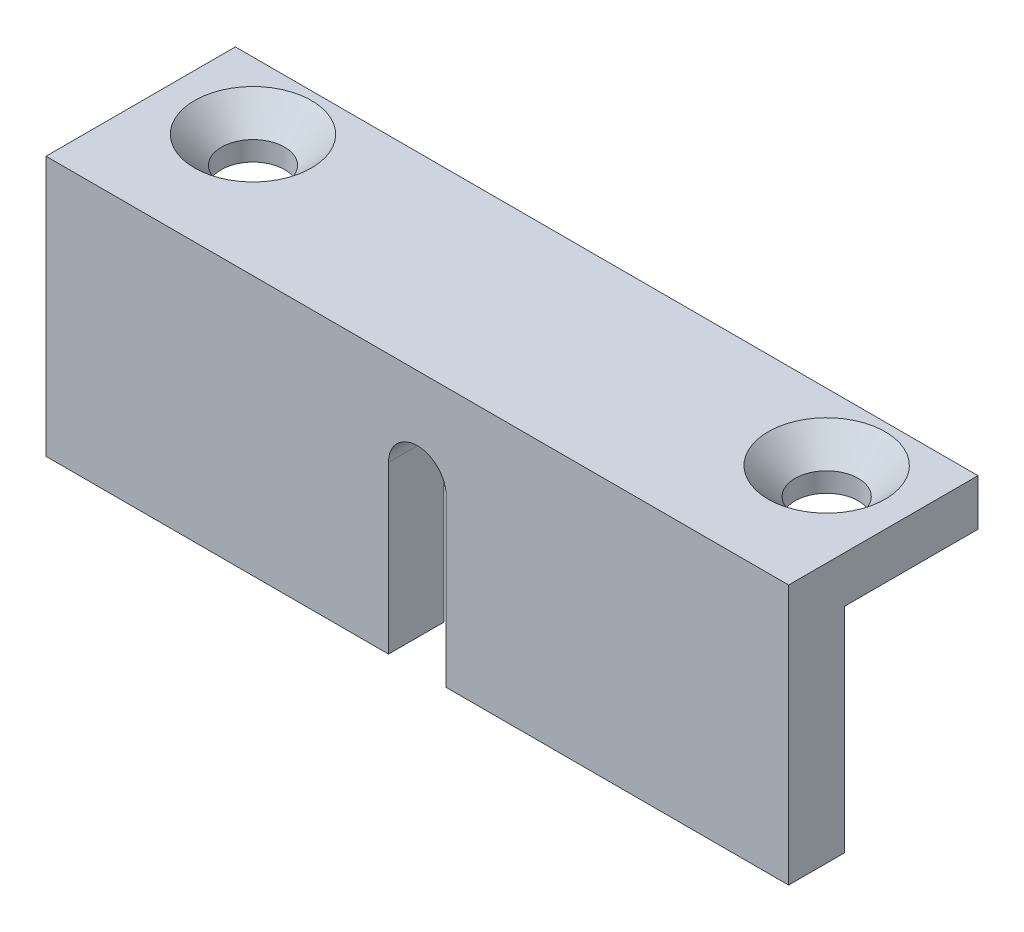
from build123d import *

# Parameters (mm, degrees)
SKETCH1_W                                      = 40
SKETCH1_H                                      = 7.2
BOSS_EXTRUDE1_DEPTH                            = 2.5
CSK_FOR_M3_FLAT_HEAD_MACHINE_SCREW1_AT_2_COUNT = 2
CSK_FOR_M3_FLAT_HEAD_MACHINE_SCREW1_AT_2_PITCH = 30.9
SKETCH4_W                                      = 40
SKETCH4_H                                      = 3
BOSS_EXTRUDE2_DEPTH                            = 14
CUT_EXTRUDE1_DEPTH                             = 43.851954448


with BuildPart() as part:
    # Sketch1 → Boss-Extrude1 (new body)
    with BuildSketch(Plane(origin=(0, 0, 0), x_dir=(1, 0, 0), z_dir=(0, 1, 0))):
        with Locations((20, 3.6)):
            Rectangle(SKETCH1_W, SKETCH1_H)
    extrude(amount=BOSS_EXTRUDE1_DEPTH)

    # Sketch3 → CSK for M3 Flat Head Machine Screw1 (revolve, cut)
    with BuildSketch(Plane(origin=(35.45, 2.5, -3.6), x_dir=(0, 0, 1), z_dir=(1, 0, 0))):
        Polygon((0, 0), (0, 2.5), (1.7, 2.5), (1.7, 1.45), (3.15, 0), align=None)
    csk_for_m3_flat_head_machine_screw1 = revolve(axis=Axis((35.45, 8.85, -3.6), (0, -1, 0)), mode=Mode.SUBTRACT)

    # CSK for M3 Flat Head Machine Screw1 at 2: CSK for M3 Flat Head Machine Screw1 ×2
    with Locations(*[(-i * CSK_FOR_M3_FLAT_HEAD_MACHINE_SCREW1_AT_2_PITCH, 0, 0) for i in range(1, CSK_FOR_M3_FLAT_HEAD_MACHINE_SCREW1_AT_2_COUNT)]):
        add(csk_for_m3_flat_head_machine_screw1, mode=Mode.SUBTRACT)

    # Sketch4 → Boss-Extrude2 (add)
    with BuildSketch(Plane(origin=(0, 2.5, 0), x_dir=(1, 0, 0), z_dir=(0, 1, 0))):
        with Locations((20, -1.5)):
            Rectangle(SKETCH4_W, SKETCH4_H)
    extrude(amount=-BOSS_EXTRUDE2_DEPTH)

    # Sketch5 → Cut-Extrude1 (cut, through all)
    with BuildSketch(Plane.XY.offset(3)):
        with BuildLine():
            Line((18.45, -2.55), (18.45, -11.5))
            Line((18.45, -11.5), (21.55, -11.5))
            Line((21.55, -11.5), (21.55, -2.55))
            ThreePointArc((21.55, -2.55), (20, -1), (18.45, -2.55))
        make_face()
        with BuildLine():
            Line((21.55, -11.5), (18.45, -11.5))
            ThreePointArc((18.45, -11.5), (20, -13.05), (21.55, -11.5))
        make_face()
    extrude(amount=-CUT_EXTRUDE1_DEPTH, mode=Mode.SUBTRACT)


solid = part.part
